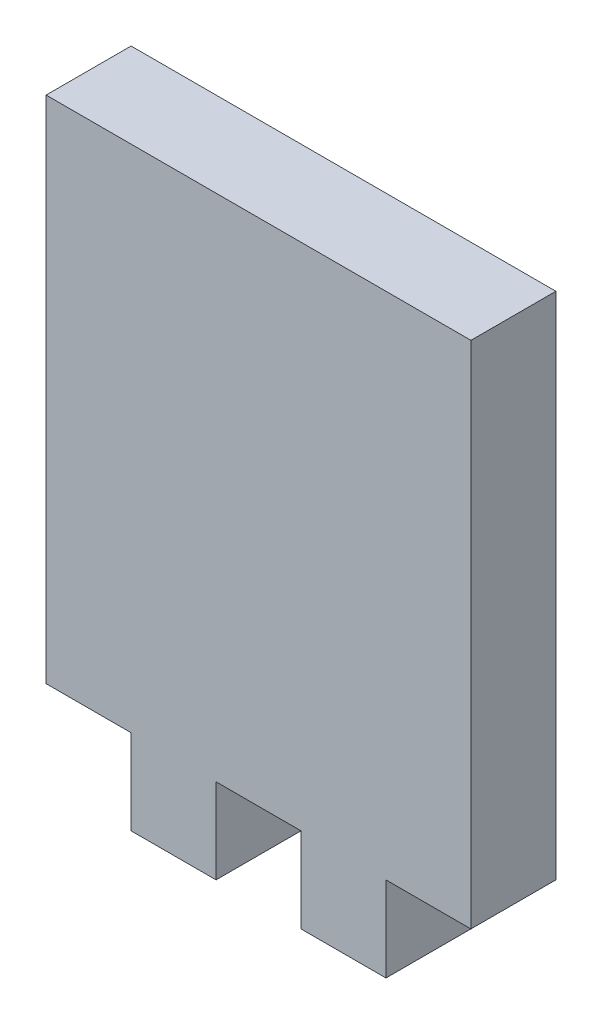
from build123d import *

# Parameters (mm, degrees)
BOSS_EXTRU_1_DEPTH = 5


with BuildPart() as part:
    # Esquisse1 → Boss.-Extru.1 (new body)
    with BuildSketch(Plane.XY):
        Polygon((-50.013400553, 4.110040759), (-45.013400553, 4.110040759), (-45.013400553, -0.889959241), (-40.013400553, -0.889959241), (-40.013400553, 4.110040759), (-35.013400553, 4.110040759), (-35.013400553, -0.889959241), (-30.013400553, -0.889959241), (-30.013400553, 4.110040759), (-25.013400553, 4.110040759), (-25.013400553, 34.110040759), (-50.013400553, 34.110040759), align=None)
    extrude(amount=BOSS_EXTRU_1_DEPTH)


solid = part.part
